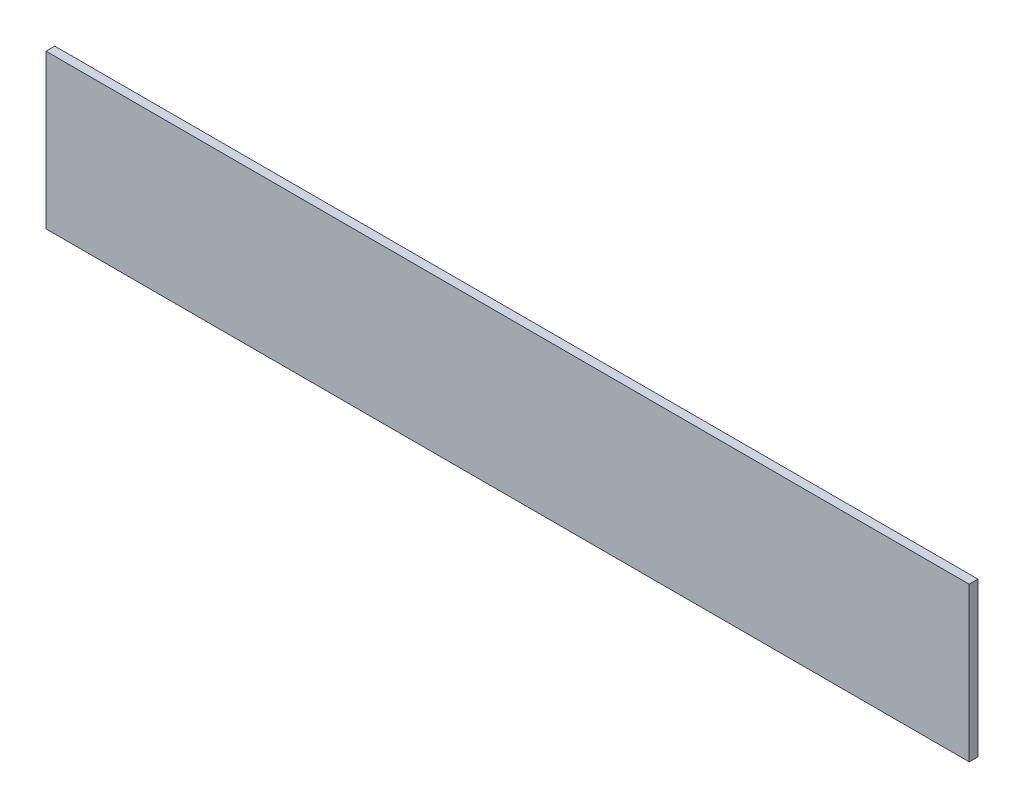
from build123d import *

# Parameters (mm, degrees)
SKETCH1_W           = 266.7
SKETCH1_H           = 44.45
BOSS_EXTRUDE1_DEPTH = 2.54


with BuildPart() as part:
    # Sketch1 → Boss-Extrude1 (new body)
    with BuildSketch(Plane.XY):
        with Locations((67.474721593, 10.976471166)):
            Rectangle(SKETCH1_W, SKETCH1_H)
    extrude(amount=BOSS_EXTRUDE1_DEPTH)


solid = part.part
